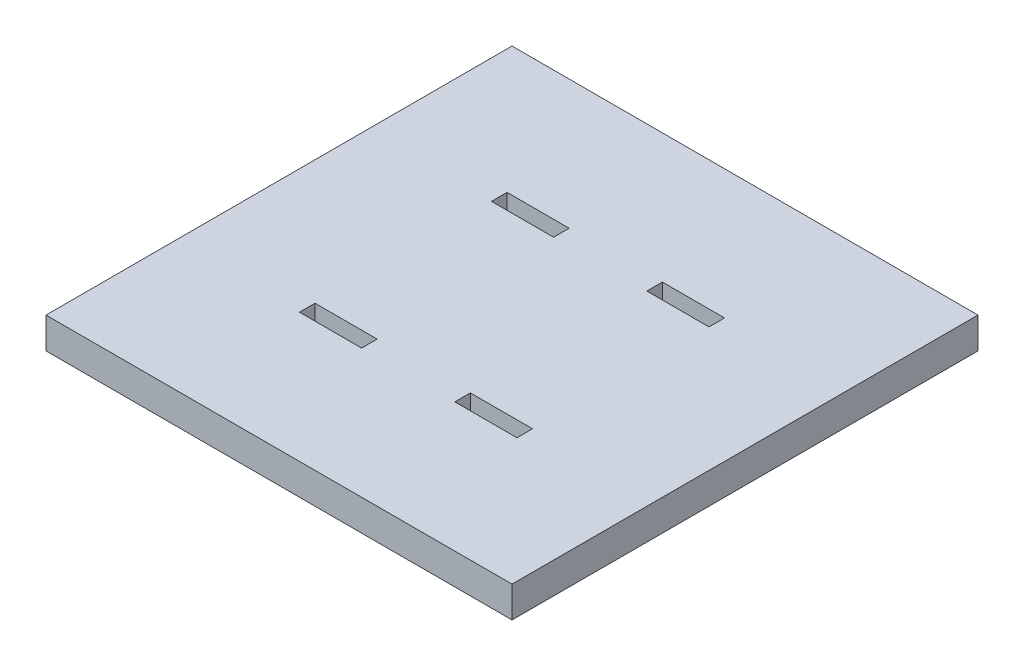
from build123d import *

# Parameters (mm, degrees)
SKETCH15_W          = 150
SKETCH15_H          = 150
SKETCH15_W_2        = 20
SKETCH15_H_2        = 5
BOSS_EXTRUDE1_DEPTH = 5


with BuildPart() as part:
    # Sketch15 → Boss-Extrude1 (new, symmetric)
    with BuildSketch(Plane(origin=(0, 0, 0), x_dir=(1, 0, 0), z_dir=(0, 1, 0))):
        Rectangle(SKETCH15_W, SKETCH15_H)
        with Locations((-25, -30.9)):
            Rectangle(SKETCH15_W_2, SKETCH15_H_2, mode=Mode.SUBTRACT)
        with Locations((25, -30.9)):
            Rectangle(SKETCH15_W_2, SKETCH15_H_2, mode=Mode.SUBTRACT)
        with Locations((25, 30.9)):
            Rectangle(SKETCH15_W_2, SKETCH15_H_2, mode=Mode.SUBTRACT)
        with Locations((-25, 30.9)):
            Rectangle(SKETCH15_W_2, SKETCH15_H_2, mode=Mode.SUBTRACT)
    extrude(amount=BOSS_EXTRUDE1_DEPTH, both=True)


with BuildPart() as part_1:
    # Body-Move/Copy1: moved
    add(part.part.moved(Location((0, -74.38, 0))))


solid = part_1.part
